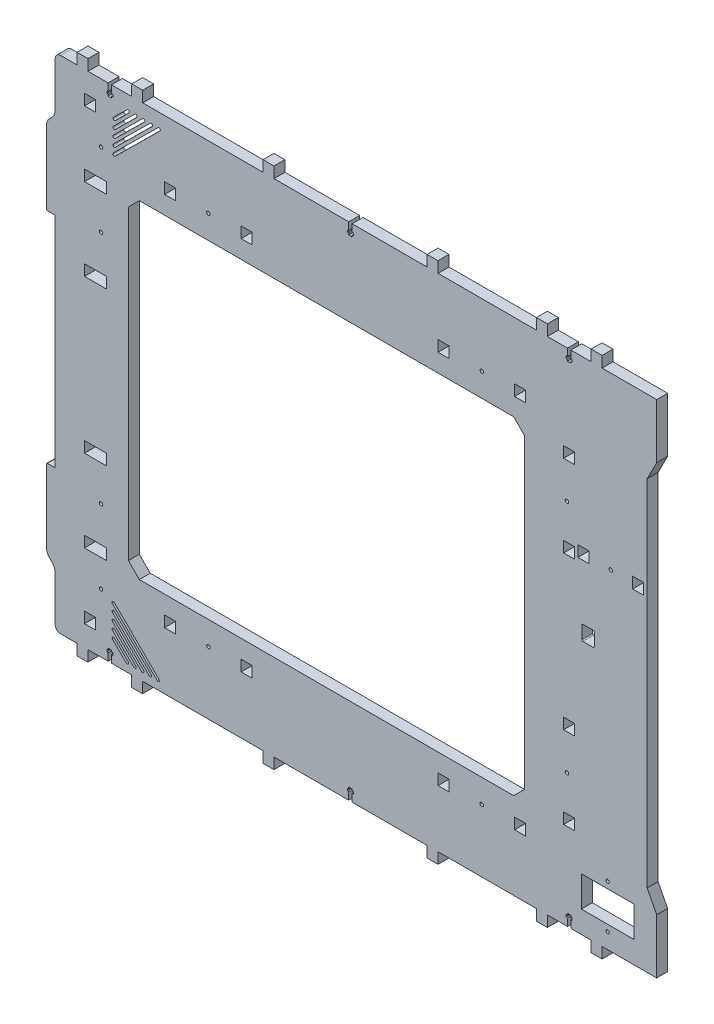
from build123d import *

# Parameters (mm, degrees)
SKETCH_1_R      = 1.6
SKETCH_1_R_2    = 1.55
SKETCH_1_W      = 20.1
SKETCH_1_H      = 10
SKETCH_1_W_2    = 10.1
SKETCH_1_W_3    = 48
SKETCH_1_H_2    = 28.000005
SKETCH_1_W_4    = 10
SKETCH_1_H_3    = 10.1
EXTRUDE_1_DEPTH = 10


with BuildPart() as part:
    # Эскиз1 → Бобышка-Вытянуть1 (new body)
    with BuildSketch(Plane.XY):
        with BuildLine():
            Line((-788.002114555, 303.522731206), (-779.302114555, 286.522731206))
            Line((-779.302114555, 286.522731206), (-779.302114555, 236.522731206))
            Line((-779.302114555, 236.522731206), (-829.202114555, 236.522731206))
            Line((-829.202114555, 236.522731206), (-829.235471032, 226.524119805))
            Line((-829.235471032, 226.524119805), (-839.235471032, 226.524119805))
            Line((-839.235471032, 226.524119805), (-839.402114555, 236.522731206))
            Line((-839.402114555, 236.522731206), (-857.752114555, 236.522731206))
            Line((-857.752114555, 236.522731206), (-857.752114555, 243.322731206))
            Line((-857.752114555, 243.322731206), (-856.552114555, 243.322731206))
            Line((-856.552114555, 243.322731206), (-856.552114555, 245.522731206))
            Line((-856.552114555, 245.522731206), (-857.752114555, 245.522731206))
            Line((-857.752114555, 245.522731206), (-857.752114555, 247.022731206))
            Line((-857.752114555, 247.022731206), (-860.852114555, 247.022731206))
            Line((-860.852114555, 247.022731206), (-860.852114555, 245.522731206))
            Line((-860.852114555, 245.522731206), (-862.052114555, 245.522731206))
            Line((-862.052114555, 245.522731206), (-862.052114555, 243.322731206))
            Line((-862.052114555, 243.322731206), (-860.852114555, 243.322731206))
            Line((-860.852114555, 243.322731206), (-860.852114555, 236.522731206))
            Line((-860.852114555, 236.522731206), (-879.202114555, 236.522731206))
            Line((-879.202114555, 236.522731206), (-879.235471032, 226.524119805))
            Line((-879.235471032, 226.524119805), (-889.235471032, 226.524119805))
            Line((-889.235471032, 226.524119805), (-889.402114555, 236.522731206))
            Line((-889.402114555, 236.522731206), (-979.202114555, 236.522731206))
            Line((-979.202114555, 236.522731206), (-979.235471032, 226.524119805))
            Line((-979.235471032, 226.524119805), (-989.235471032, 226.524119805))
            Line((-989.235471032, 226.524119805), (-989.402114555, 236.522731206))
            Line((-989.402114555, 236.522731206), (-1057.752114555, 236.522731206))
            Line((-1057.752114555, 236.522731206), (-1057.752114555, 243.322731206))
            Line((-1057.752114555, 243.322731206), (-1056.552114555, 243.322731206))
            Line((-1056.552114555, 243.322731206), (-1056.552114555, 245.522731206))
            Line((-1056.552114555, 245.522731206), (-1057.752114555, 245.522731206))
            Line((-1057.752114555, 245.522731206), (-1057.752114555, 247.022731206))
            Line((-1057.752114555, 247.022731206), (-1060.852114555, 247.022731206))
            Line((-1060.852114555, 247.022731206), (-1060.852114555, 245.522731206))
            Line((-1060.852114555, 245.522731206), (-1062.052114555, 245.522731206))
            Line((-1062.052114555, 245.522731206), (-1062.052114555, 243.322731206))
            Line((-1062.052114555, 243.322731206), (-1060.852114555, 243.322731206))
            Line((-1060.852114555, 243.322731206), (-1060.852114555, 236.522731206))
            Line((-1060.852114555, 236.522731206), (-1129.202114555, 236.522731206))
            Line((-1129.202114555, 236.522731206), (-1129.235471032, 226.524119805))
            Line((-1129.235471032, 226.524119805), (-1139.235471032, 226.524119805))
            Line((-1139.235471032, 226.524119805), (-1139.402114555, 236.522731206))
            Line((-1139.402114555, 236.522731206), (-1249.202114555, 236.522731206))
            Line((-1249.202114555, 236.522731206), (-1249.368758079, 226.524119805))
            Line((-1249.368758079, 226.524119805), (-1259.368758079, 226.524119805))
            Line((-1259.368758079, 226.524119805), (-1259.402114555, 236.522731206))
            Line((-1259.402114555, 236.522731206), (-1277.752114555, 236.522731206))
            Line((-1277.752114555, 236.522731206), (-1277.752114555, 243.322731206))
            Line((-1277.752114555, 243.322731206), (-1276.552114555, 243.322731206))
            Line((-1276.552114555, 243.322731206), (-1276.552114555, 245.522731206))
            Line((-1276.552114555, 245.522731206), (-1277.752114555, 245.522731206))
            Line((-1277.752114555, 245.522731206), (-1277.752114555, 247.022731206))
            Line((-1277.752114555, 247.022731206), (-1280.852114555, 247.022731206))
            Line((-1280.852114555, 247.022731206), (-1280.852114555, 245.522731206))
            Line((-1280.852114555, 245.522731206), (-1282.052114555, 245.522731206))
            Line((-1282.052114555, 245.522731206), (-1282.052114555, 243.322731206))
            Line((-1282.052114555, 243.322731206), (-1280.852114555, 243.322731206))
            Line((-1280.852114555, 243.322731206), (-1280.852114555, 236.522731206))
            Line((-1280.852114555, 236.522731206), (-1299.202114555, 236.522731206))
            Line((-1299.202114555, 236.522731206), (-1299.368758079, 226.524119805))
            Line((-1299.368758079, 226.524119805), (-1309.368758079, 226.524119805))
            Line((-1309.368758079, 226.524119805), (-1309.402114555, 236.522731206))
            Line((-1309.402114555, 236.522731206), (-1324.302114555, 236.522731206))
            ThreePointArc((-1324.302114555, 236.522731206), (-1327.837648461, 237.9871973), (-1329.302114555, 241.522731206))
            Line((-1329.302114555, 241.522731206), (-1329.302114555, 282.380596206))
            ThreePointArc((-1329.302114555, 282.380596206), (-1330.063319299, 286.207430071), (-1332.231046555, 289.451663206))
            Line((-1332.231046555, 289.451663206), (-1334.373182555, 291.593799206))
            ThreePointArc((-1334.373182555, 291.593799206), (-1336.540910003, 294.838032803), (-1337.302114555, 298.664867206))
            Line((-1337.302114555, 298.664867206), (-1337.302114555, 364.522731206))
            ThreePointArc((-1337.302114555, 364.522731206), (-1337.009221337, 365.229837987), (-1336.302114555, 365.522731206))
            Line((-1336.302114555, 365.522731206), (-1329.302114555, 365.522731206))
            Line((-1329.302114555, 365.522731206), (-1329.302114555, 565.522731206))
            Line((-1329.302114555, 565.522731206), (-1336.302114555, 565.522731206))
            ThreePointArc((-1336.302114555, 565.522731206), (-1337.009221337, 565.815624425), (-1337.302114555, 566.522731206))
            Line((-1337.302114555, 566.522731206), (-1337.302114555, 632.380596206))
            ThreePointArc((-1337.302114555, 632.380596206), (-1336.540909812, 636.207430071), (-1334.373182555, 639.451663206))
            Line((-1334.373182555, 639.451663206), (-1332.231046555, 641.593799206))
            ThreePointArc((-1332.231046555, 641.593799206), (-1330.063319107, 644.838032803), (-1329.302114555, 648.664867206))
            Line((-1329.302114555, 648.664867206), (-1329.302114555, 689.522731206))
            ThreePointArc((-1329.302114555, 689.522731206), (-1327.837648461, 693.058265112), (-1324.302114555, 694.522731206))
            Line((-1324.302114555, 694.522731206), (-1309.402114555, 694.522731206))
            Line((-1309.402114555, 694.522731206), (-1309.235471032, 704.521342606))
            Line((-1309.235471032, 704.521342606), (-1299.235471032, 704.521342606))
            Line((-1299.235471032, 704.521342606), (-1299.202114555, 694.522731206))
            Line((-1299.202114555, 694.522731206), (-1280.852114555, 694.522731206))
            Line((-1280.852114555, 694.522731206), (-1280.852114555, 687.722731206))
            Line((-1280.852114555, 687.722731206), (-1282.052114555, 687.722731206))
            Line((-1282.052114555, 687.722731206), (-1282.052114555, 685.522731206))
            Line((-1282.052114555, 685.522731206), (-1280.852114555, 685.522731206))
            Line((-1280.852114555, 685.522731206), (-1280.852114555, 684.022731206))
            Line((-1280.852114555, 684.022731206), (-1277.752114555, 684.022731206))
            Line((-1277.752114555, 684.022731206), (-1277.752114555, 685.522731206))
            Line((-1277.752114555, 685.522731206), (-1276.552114555, 685.522731206))
            Line((-1276.552114555, 685.522731206), (-1276.552114555, 687.722731206))
            Line((-1276.552114555, 687.722731206), (-1277.752114555, 687.722731206))
            Line((-1277.752114555, 687.722731206), (-1277.752114555, 694.522731206))
            Line((-1277.752114555, 694.522731206), (-1259.402114555, 694.522731206))
            Line((-1259.402114555, 694.522731206), (-1259.235471032, 704.521342606))
            Line((-1259.235471032, 704.521342606), (-1249.235471032, 704.521342606))
            Line((-1249.235471032, 704.521342606), (-1249.202114555, 694.522731206))
            Line((-1249.202114555, 694.522731206), (-1139.402114555, 694.522731206))
            Line((-1139.402114555, 694.522731206), (-1139.235471032, 704.521342606))
            Line((-1139.235471032, 704.521342606), (-1129.235471032, 704.521342606))
            Line((-1129.235471032, 704.521342606), (-1129.202114555, 694.522731206))
            Line((-1129.202114555, 694.522731206), (-1060.852114555, 694.522731206))
            Line((-1060.852114555, 694.522731206), (-1060.852114555, 687.722731206))
            Line((-1060.852114555, 687.722731206), (-1062.052114555, 687.722731206))
            Line((-1062.052114555, 687.722731206), (-1062.052114555, 685.522731206))
            Line((-1062.052114555, 685.522731206), (-1060.852114555, 685.522731206))
            Line((-1060.852114555, 685.522731206), (-1060.852114555, 684.022731206))
            Line((-1060.852114555, 684.022731206), (-1057.752114555, 684.022731206))
            Line((-1057.752114555, 684.022731206), (-1057.752114555, 685.522731206))
            Line((-1057.752114555, 685.522731206), (-1056.552114555, 685.522731206))
            Line((-1056.552114555, 685.522731206), (-1056.552114555, 687.722731206))
            Line((-1056.552114555, 687.722731206), (-1057.752114555, 687.722731206))
            Line((-1057.752114555, 687.722731206), (-1057.752114555, 694.522731206))
            Line((-1057.752114555, 694.522731206), (-989.402114555, 694.522731206))
            Line((-989.402114555, 694.522731206), (-989.235471032, 704.521342606))
            Line((-989.235471032, 704.521342606), (-979.235471032, 704.521342606))
            Line((-979.235471032, 704.521342606), (-979.202114555, 694.522731206))
            Line((-979.202114555, 694.522731206), (-889.402114555, 694.522731206))
            Line((-889.402114555, 694.522731206), (-889.235471032, 704.521342606))
            Line((-889.235471032, 704.521342606), (-879.235471032, 704.521342606))
            Line((-879.235471032, 704.521342606), (-879.202114555, 694.522731206))
            Line((-879.202114555, 694.522731206), (-860.852114555, 694.522731206))
            Line((-860.852114555, 694.522731206), (-860.852114555, 687.722731206))
            Line((-860.852114555, 687.722731206), (-862.052114555, 687.722731206))
            Line((-862.052114555, 687.722731206), (-862.052114555, 685.522731206))
            Line((-862.052114555, 685.522731206), (-860.852114555, 685.522731206))
            Line((-860.852114555, 685.522731206), (-860.852114555, 684.022731206))
            Line((-860.852114555, 684.022731206), (-857.752114555, 684.022731206))
            Line((-857.752114555, 684.022731206), (-857.752114555, 685.522731206))
            Line((-857.752114555, 685.522731206), (-856.552114555, 685.522731206))
            Line((-856.552114555, 685.522731206), (-856.552114555, 687.722731206))
            Line((-856.552114555, 687.722731206), (-857.752114555, 687.722731206))
            Line((-857.752114555, 687.722731206), (-857.752114555, 694.522731206))
            Line((-857.752114555, 694.522731206), (-839.402114555, 694.522731206))
            Line((-839.402114555, 694.522731206), (-839.235471032, 704.521342606))
            Line((-839.235471032, 704.521342606), (-829.235471032, 704.521342606))
            Line((-829.235471032, 704.521342606), (-829.202114555, 694.522731206))
            Line((-829.202114555, 694.522731206), (-779.302114555, 694.522731206))
            Line((-779.302114555, 694.522731206), (-779.302114555, 644.522731206))
            Line((-779.302114555, 644.522731206), (-788.002114555, 627.522731206))
            Line((-788.002114555, 627.522731206), (-788.002114555, 303.522731206))
        make_face()
        with Locations((-1287.352114555, 358.022731206)):
            Circle(SKETCH_1_R, mode=Mode.SUBTRACT)
        with Locations((-861.349789555, 358.022731206)):
            Circle(SKETCH_1_R, mode=Mode.SUBTRACT)
        with Locations((-1287.352114555, 573.022731206)):
            Circle(SKETCH_1_R, mode=Mode.SUBTRACT)
        with Locations((-861.349789555, 573.022731206)):
            Circle(SKETCH_1_R, mode=Mode.SUBTRACT)
        with Locations((-1287.352114555, 290.522731206)):
            Circle(SKETCH_1_R, mode=Mode.SUBTRACT)
        with Locations((-1287.352114555, 640.522731206)):
            Circle(SKETCH_1_R, mode=Mode.SUBTRACT)
        with Locations((-824.172463555, 290.673203206)):
            Circle(SKETCH_1_R_2, mode=Mode.SUBTRACT)
        with Locations((-824.172463555, 250.673203206)):
            Circle(SKETCH_1_R_2, mode=Mode.SUBTRACT)
        with Locations((-1189.202114555, 293.972731202)):
            Circle(SKETCH_1_R, mode=Mode.SUBTRACT)
        with Locations((-939.202114555, 293.972731202)):
            Circle(SKETCH_1_R, mode=Mode.SUBTRACT)
        with Locations((-1189.202114555, 637.072731202)):
            Circle(SKETCH_1_R, mode=Mode.SUBTRACT)
        with Locations((-939.202114555, 637.072731202)):
            Circle(SKETCH_1_R, mode=Mode.SUBTRACT)
        with Locations((-821.299789555, 538.644101754)):
            Circle(SKETCH_1_R, mode=Mode.SUBTRACT)
        with Locations((-1292.352114555, 535.522731206)):
            Rectangle(SKETCH_1_W, SKETCH_1_H, mode=Mode.SUBTRACT)
        with Locations((-1292.352114555, 395.522731206)):
            Rectangle(SKETCH_1_W, SKETCH_1_H, mode=Mode.SUBTRACT)
        with Locations((-1292.352114555, 610.522731206)):
            Rectangle(SKETCH_1_W, SKETCH_1_H, mode=Mode.SUBTRACT)
        with Locations((-1292.352114555, 320.522731206)):
            Rectangle(SKETCH_1_W, SKETCH_1_H, mode=Mode.SUBTRACT)
        with Locations((-1297.352114555, 670.522731206)):
            Rectangle(SKETCH_1_W_2, SKETCH_1_H, mode=Mode.SUBTRACT)
        with Locations((-1297.352114555, 260.522731206)):
            Rectangle(SKETCH_1_W_2, SKETCH_1_H, mode=Mode.SUBTRACT)
        with Locations((-859.349789555, 535.522731206)):
            Rectangle(SKETCH_1_W_2, SKETCH_1_H, mode=Mode.SUBTRACT)
        with Locations((-859.349789555, 395.522731206)):
            Rectangle(SKETCH_1_W_2, SKETCH_1_H, mode=Mode.SUBTRACT)
        with Locations((-859.349789555, 320.522731206)):
            Rectangle(SKETCH_1_W_2, SKETCH_1_H, mode=Mode.SUBTRACT)
        with Locations((-859.349789555, 610.522731206)):
            Rectangle(SKETCH_1_W_2, SKETCH_1_H, mode=Mode.SUBTRACT)
        with Locations((-824.172463555, 270.673204706)):
            Rectangle(SKETCH_1_W_3, SKETCH_1_H_2, mode=Mode.SUBTRACT)
        with Locations((-1224.202114555, 293.972731206)):
            Rectangle(SKETCH_1_W_4, SKETCH_1_H_3, mode=Mode.SUBTRACT)
        with Locations((-904.202114555, 293.972731206)):
            Rectangle(SKETCH_1_W_4, SKETCH_1_H_3, mode=Mode.SUBTRACT)
        with Locations((-1154.202114555, 293.972731206)):
            Rectangle(SKETCH_1_W_4, SKETCH_1_H_3, mode=Mode.SUBTRACT)
        with Locations((-974.202114555, 293.972731206)):
            Rectangle(SKETCH_1_W_4, SKETCH_1_H_3, mode=Mode.SUBTRACT)
        with Locations((-1224.202114555, 637.072731206)):
            Rectangle(SKETCH_1_W_4, SKETCH_1_H_3, mode=Mode.SUBTRACT)
        with Locations((-904.202114555, 637.072731206)):
            Rectangle(SKETCH_1_W_4, SKETCH_1_H_3, mode=Mode.SUBTRACT)
        with Locations((-1154.202114555, 637.072731206)):
            Rectangle(SKETCH_1_W_4, SKETCH_1_H_3, mode=Mode.SUBTRACT)
        with Locations((-974.202114555, 637.072731206)):
            Rectangle(SKETCH_1_W_4, SKETCH_1_H_3, mode=Mode.SUBTRACT)
        with BuildLine():
            Line((-1257.289156555, 243.596861206), (-1276.841727555, 262.934569206))
            ThreePointArc((-1276.841727555, 262.934569206), (-1276.851494055, 264.702308706), (-1275.083754555, 264.712075206))
            Line((-1275.083754555, 264.712075206), (-1255.531182555, 245.374367206))
            ThreePointArc((-1255.531182555, 245.374367206), (-1255.521416555, 243.606627206), (-1257.289156555, 243.596861206))
        make_face(mode=Mode.SUBTRACT)
        with BuildLine():
            Line((-1250.218196555, 243.635927206), (-1276.880793555, 270.005529206))
            ThreePointArc((-1276.880793555, 270.005529206), (-1276.890560055, 271.773268706), (-1275.122820555, 271.783035206))
            Line((-1275.122820555, 271.783035206), (-1248.460222555, 245.413433206))
            ThreePointArc((-1248.460222555, 245.413433206), (-1248.450456555, 243.645693206), (-1250.218196555, 243.635927206))
        make_face(mode=Mode.SUBTRACT)
        with BuildLine():
            Line((-1243.147236555, 243.674993206), (-1276.919859555, 277.076489206))
            ThreePointArc((-1276.919859555, 277.076489206), (-1276.929626055, 278.844228706), (-1275.161886555, 278.853995206))
            Line((-1275.161886555, 278.853995206), (-1241.389262555, 245.452500206))
            ThreePointArc((-1241.389262555, 245.452500206), (-1241.379496055, 243.684759706), (-1243.147236555, 243.674993206))
        make_face(mode=Mode.SUBTRACT)
        with BuildLine():
            Line((-1264.360116555, 243.557795206), (-1276.802661555, 255.863609206))
            ThreePointArc((-1276.802661555, 255.863609206), (-1276.812428055, 257.631348706), (-1275.044688555, 257.641115206))
            Line((-1275.044688555, 257.641115206), (-1262.602142555, 245.335301206))
            ThreePointArc((-1262.602142555, 245.335301206), (-1262.592376555, 243.567561206), (-1264.360116555, 243.557795206))
        make_face(mode=Mode.SUBTRACT)
        with BuildLine():
            Line((-1236.076276555, 243.714059206), (-1276.958925555, 284.147449206))
            ThreePointArc((-1276.958925555, 284.147449206), (-1276.968692055, 285.915188706), (-1275.200952555, 285.924955206))
            Line((-1275.200952555, 285.924955206), (-1234.318303555, 245.491566206))
            ThreePointArc((-1234.318303555, 245.491566206), (-1234.308536555, 243.723826206), (-1236.076276555, 243.714059206))
        make_face(mode=Mode.SUBTRACT)
        with BuildLine():
            Line((-1256.452988555, 681.974422206), (-1276.005559555, 662.636714206))
            ThreePointArc((-1276.005559555, 662.636714206), (-1276.015326555, 660.868974206), (-1274.247586555, 660.859207206))
            Line((-1274.247586555, 660.859207206), (-1254.695014555, 680.196915206))
            ThreePointArc((-1254.695014555, 680.196915206), (-1254.685248055, 681.964655706), (-1256.452988555, 681.974422206))
        make_face(mode=Mode.SUBTRACT)
        with BuildLine():
            Line((-1249.382028555, 681.935356206), (-1276.044625555, 655.565754206))
            ThreePointArc((-1276.044625555, 655.565754206), (-1276.054392555, 653.798014206), (-1274.286652555, 653.788247206))
            Line((-1274.286652555, 653.788247206), (-1247.624054555, 680.157849206))
            ThreePointArc((-1247.624054555, 680.157849206), (-1247.614288055, 681.925589706), (-1249.382028555, 681.935356206))
        make_face(mode=Mode.SUBTRACT)
        with BuildLine():
            Line((-1242.311068555, 681.896290206), (-1276.083691555, 648.494794206))
            ThreePointArc((-1276.083691555, 648.494794206), (-1276.093458555, 646.727054206), (-1274.325718555, 646.717287206))
            Line((-1274.325718555, 646.717287206), (-1240.553095555, 680.118783206))
            ThreePointArc((-1240.553095555, 680.118783206), (-1240.543328555, 681.886523206), (-1242.311068555, 681.896290206))
        make_face(mode=Mode.SUBTRACT)
        with BuildLine():
            Line((-1263.523948555, 682.013488206), (-1275.966493555, 669.707674206))
            ThreePointArc((-1275.966493555, 669.707674206), (-1275.976260555, 667.939934206), (-1274.208520555, 667.930167206))
            Line((-1274.208520555, 667.930167206), (-1261.765974555, 680.235981206))
            ThreePointArc((-1261.765974555, 680.235981206), (-1261.756208055, 682.003721706), (-1263.523948555, 682.013488206))
        make_face(mode=Mode.SUBTRACT)
        with BuildLine():
            Line((-1235.240108555, 681.857224206), (-1276.122758555, 641.423834206))
            ThreePointArc((-1276.122758555, 641.423834206), (-1276.132524555, 639.656094206), (-1274.364784555, 639.646328206))
            Line((-1274.364784555, 639.646328206), (-1233.482135555, 680.079717206))
            ThreePointArc((-1233.482135555, 680.079717206), (-1233.472368555, 681.847457206), (-1235.240108555, 681.857224206))
        make_face(mode=Mode.SUBTRACT)
        with BuildLine():
            Line((-846.799789825, 469.322731206), (-837.299789825, 469.322731206))
            ThreePointArc((-837.299789825, 469.322731206), (-836.592683044, 469.615624425), (-836.299789825, 470.322731206))
            Line((-836.299789825, 470.322731206), (-836.299789825, 481.822731206))
            ThreePointArc((-836.299789825, 481.822731206), (-836.592683044, 482.529837987), (-837.299789825, 482.822731206))
            Line((-837.299789825, 482.822731206), (-846.799789825, 482.822731206))
            ThreePointArc((-846.799789825, 482.822731206), (-847.506896607, 482.529837987), (-847.799789825, 481.822731206))
            Line((-847.799789825, 481.822731206), (-847.799789825, 470.322731206))
            ThreePointArc((-847.799789825, 470.322731206), (-847.506896607, 469.615624425), (-846.799789825, 469.322731206))
        make_face(mode=Mode.SUBTRACT)
        Polygon((-1262.302114555, 325.522731206), (-1262.302114555, 605.522731206), (-1252.302114555, 615.522731206), (-910.087295458, 615.522731206), (-900.087295458, 605.522731206), (-900.087295458, 325.522731206), (-910.087295458, 315.522731206), (-1252.302114555, 315.522731206), align=None, mode=Mode.SUBTRACT)
        with Locations((-846.299789555, 538.644101754)):
            Rectangle(SKETCH_1_W_4, SKETCH_1_H_3, mode=Mode.SUBTRACT)
        with Locations((-796.299789555, 538.644101754)):
            Rectangle(SKETCH_1_W_4, SKETCH_1_H_3, mode=Mode.SUBTRACT)
    extrude(amount=EXTRUDE_1_DEPTH)


solid = part.part
